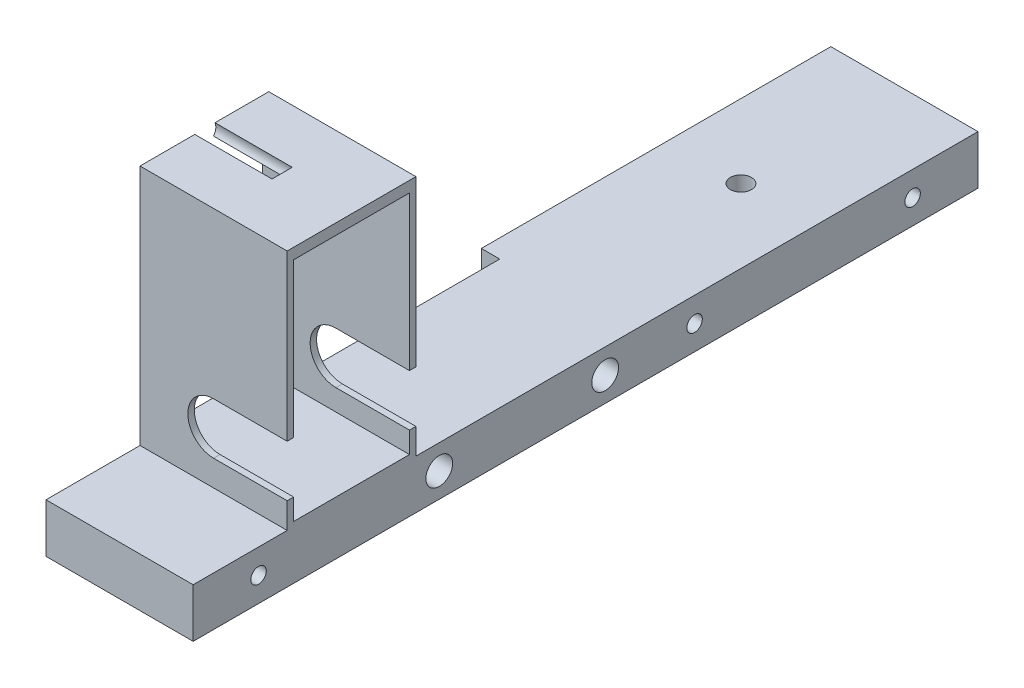
from build123d import *

# Parameters (mm, degrees)
SKETCH2_W             = 28.575
SKETCH2_H             = 152.4
BOSS_EXTRUDE1_DEPTH   = 9.525
F_3_0MM_DOWEL_HOLE1_D = 3
LPATTERN1_COUNT       = 4
LPATTERN1_PITCH       = 42.333333333
SKETCH12_R            = 2.05
CUT_EXTRUDE1_DEPTH    = 156.348048749
SKETCH12_4_R          = 10.975
CUT_EXTRUDE2_DEPTH    = 4
SKETCH15_R            = 2.5
CUT_EXTRUDE3_DEPTH    = 156.154169296
SKETCH13_R            = 2.6
CUT_EXTRUDE4_DEPTH    = 156.348048749
SKETCH17_W            = 41.28
SKETCH17_H            = 9.525
CUT_EXTRUDE5_DEPTH    = 3.575
SKETCH18_W            = 28.575
SKETCH18_H            = 25
BOSS_EXTRUDE3_DEPTH   = 47
CUT_EXTRUDE12_REACH   = 167.037
SKETCH19_W            = 22.5
SKETCH19_H            = 44
CUT_EXTRUDE18_DEPTH   = 15
CUT_EXTRUDE17_DEPTH   = 25


with BuildPart() as part:
    # Sketch2 → Boss-Extrude1 (new body)
    with BuildSketch(Plane(origin=(0, 0, 0), x_dir=(1, 0, 0), z_dir=(0, 1, 0))):
        with Locations((14.2875, 76.2)):
            Rectangle(SKETCH2_W, SKETCH2_H)
    extrude(amount=BOSS_EXTRUDE1_DEPTH)

    # Ø3.0mm Dowel Hole1 (through all)
    with Locations(Plane.ZY):
        with Locations((-139.7, 4.7625)):
            f_3_0mm_dowel_hole1 = Hole(F_3_0MM_DOWEL_HOLE1_D / 2)

    # LPattern1: Ø3.0mm Dowel Hole1 ×4, 1 skipped
    with Locations(*[(0, 0, i * LPATTERN1_PITCH) for i in range(1, LPATTERN1_COUNT) if i not in (2,)]):
        add(f_3_0mm_dowel_hole1, mode=Mode.SUBTRACT)

    # Sketch12 → Cut-Extrude1 (cut, through all)
    with BuildSketch(Plane(origin=(0, 9.525, 0), x_dir=(1, 0, 0), z_dir=(0, 1, 0))):
        with Locations(Location((14.2875, 120.65, 0), (0, 0, 270))):
            Circle(SKETCH12_R)
    extrude(amount=-CUT_EXTRUDE1_DEPTH, mode=Mode.SUBTRACT)

    # Sketch12<4> → Cut-Extrude2 (cut)
    with BuildSketch(Plane(origin=(0, 9.525, 0), x_dir=(1, 0, 0), z_dir=(0, 1, 0))):
        with Locations(Location((14.2875, 31.75, 0), (0, 0, 270))):
            Circle(SKETCH12_4_R)
    extrude(amount=-CUT_EXTRUDE2_DEPTH, mode=Mode.SUBTRACT)

    # Sketch15 → Cut-Extrude3 (cut, through all)
    with BuildSketch(Plane(origin=(0, 5.525, 0), x_dir=(1, 0, 0), z_dir=(0, 1, 0))):
        with Locations(Location((14.2875, 31.75, 0), (0, 0, 270))):
            Circle(SKETCH15_R)
    extrude(amount=-CUT_EXTRUDE3_DEPTH, mode=Mode.SUBTRACT)

    # Sketch13 → Cut-Extrude4 (cut, through all)
    with BuildSketch(Plane.ZY):
        with Locations((-80, 4.7625)):
            Circle(SKETCH13_R)
        with Locations((-47.79, 4.7625)):
            Circle(SKETCH13_R)
    extrude(amount=-CUT_EXTRUDE4_DEPTH, mode=Mode.SUBTRACT)

    # Sketch17 → Cut-Extrude5 (cut)
    with BuildSketch(Plane.ZY):
        with Locations((-63.895, 4.7625)):
            Rectangle(SKETCH17_W, SKETCH17_H)
    extrude(amount=-CUT_EXTRUDE5_DEPTH, mode=Mode.SUBTRACT)

    # Sketch18 → Boss-Extrude3 (add)
    with BuildSketch(Plane(origin=(0, 9.525, 0), x_dir=(1, 0, 0), z_dir=(0, 1, 0))):
        with Locations((14.2875, 30.755)):
            Rectangle(SKETCH18_W, SKETCH18_H)
    extrude(amount=BOSS_EXTRUDE3_DEPTH)

    # Sketch19 → Cut-Extrude12 (cut, up to next)
    with BuildSketch(Plane.ZY, mode=Mode.PRIVATE) as cut_extrude12_sk1:
        with Locations((-30.755, 32.413500749)):
            Rectangle(SKETCH19_W, SKETCH19_H)
    cut_extrude12_tool1 = extrude(cut_extrude12_sk1.sketch, amount=-CUT_EXTRUDE12_REACH, mode=Mode.PRIVATE) & part.part
    add(cut_extrude12_tool1.solids().sort_by_distance((0, 32.413501, -30.755))[0], mode=Mode.SUBTRACT)

    # Sketch20 → Cut-Extrude18 (cut)
    with BuildSketch(Plane.ZY):
        with BuildLine():
            Line((-32.81559427, 56.525), (-28.887718849, 56.525))
            ThreePointArc((-28.887718849, 56.525), (-30.851656559, 53.588833805), (-32.81559427, 56.525))
        make_face()
    extrude(amount=-CUT_EXTRUDE18_DEPTH, mode=Mode.SUBTRACT)

    # Sketch21 → Cut-Extrude17 (cut)
    with BuildSketch(Plane.XY.offset(-18.255)):
        with BuildLine():
            Line((14.2875, 24.525), (28.575, 24.525))
            Line((28.575, 24.525), (28.575, 14.525))
            Line((28.575, 14.525), (14.2875, 14.525))
            ThreePointArc((14.2875, 14.525), (9.2875, 19.525), (14.2875, 24.525))
        make_face()
    extrude(amount=-CUT_EXTRUDE17_DEPTH, mode=Mode.SUBTRACT)


solid = part.part
